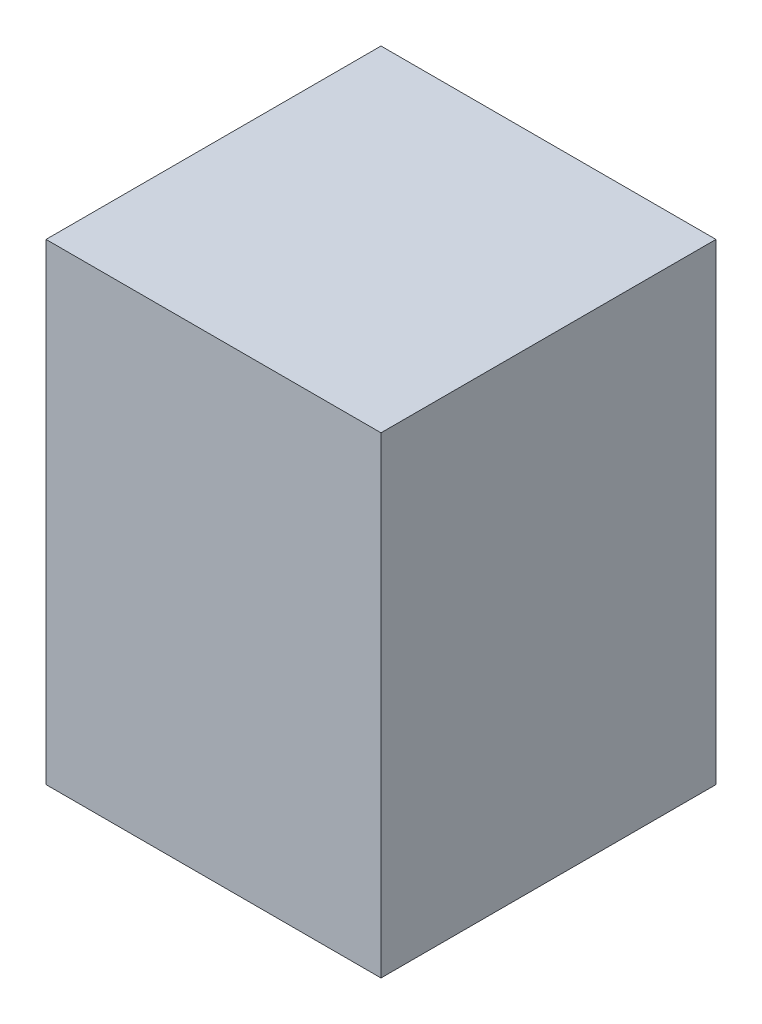
from build123d import *

# Parameters (mm, degrees)
SKETCH1_W      = 10.5
SKETCH1_H      = 10.5
EXTRUDE1_DEPTH = 14.8


with BuildPart() as part:
    # Sketch1 → Extrude1 (new body)
    with BuildSketch(Plane(origin=(0, 0, 0), x_dir=(1, 0, 0), z_dir=(0, 1, 0))):
        with Locations((5.25, 5.25)):
            Rectangle(SKETCH1_W, SKETCH1_H)
    extrude(amount=EXTRUDE1_DEPTH)


solid = part.part
